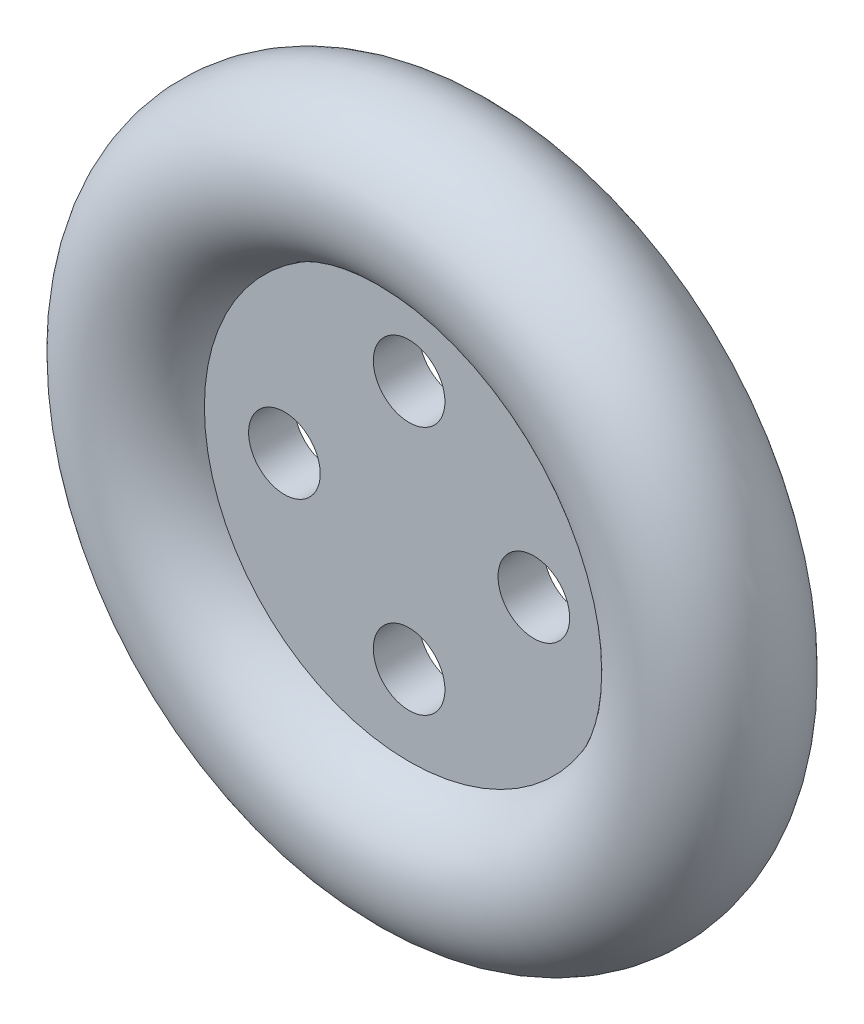
from build123d import *

# Parameters (mm, degrees)
SKETCH_2_R          = 60.502500486
EXTRUDE_1_DEPTH     = 10
SKETCH_3_R          = 16.631324813
SKETCH_3_R_2        = 6.631324813
SKETCH_3_W          = 10
SKETCH_3_H          = 10
SKETCH_4_R          = 7.809088704
CUT_EXTRUDE_1_DEPTH = 49


with BuildPart() as part:
    # 草图2 → 凸台-拉伸1 (new body)
    with BuildSketch(Plane.XY):
        Circle(SKETCH_2_R)
    extrude(amount=EXTRUDE_1_DEPTH)

    # 草图3 → 旋转-薄壁1 (revolve)
    # profile 1 of 2: a face of its own
    with BuildSketch(Plane(origin=(0, 0, 0), x_dir=(1, 0, 0), z_dir=(0, 1, 0))):
        with Locations((-60.502500486, -5)):
            Circle(SKETCH_3_R)
        with Locations((-60.502500486, -5)):
            Circle(SKETCH_3_R_2, mode=Mode.SUBTRACT)
    # profile 2 of 2: a face of its own
    with BuildSketch(Plane(origin=(0, 0, 0), x_dir=(1, 0, 0), z_dir=(0, 1, 0))):
        with Locations((-5, -5)):
            Rectangle(SKETCH_3_W, SKETCH_3_H)
    revolve(axis=Axis((0, 0, 0), (0, 0, 1)))

    # 草图4 → 切除-拉伸1 (cut)
    with BuildSketch(Plane.XY):
        with Locations((0, 27.189269827)):
            Circle(SKETCH_4_R)
        with Locations((27.189269827, 0)):
            Circle(SKETCH_4_R)
        with Locations((0, -27.189269827)):
            Circle(SKETCH_4_R)
        with Locations((-27.189269827, 0)):
            Circle(SKETCH_4_R)
    extrude(amount=CUT_EXTRUDE_1_DEPTH, mode=Mode.SUBTRACT)


solid = part.part
